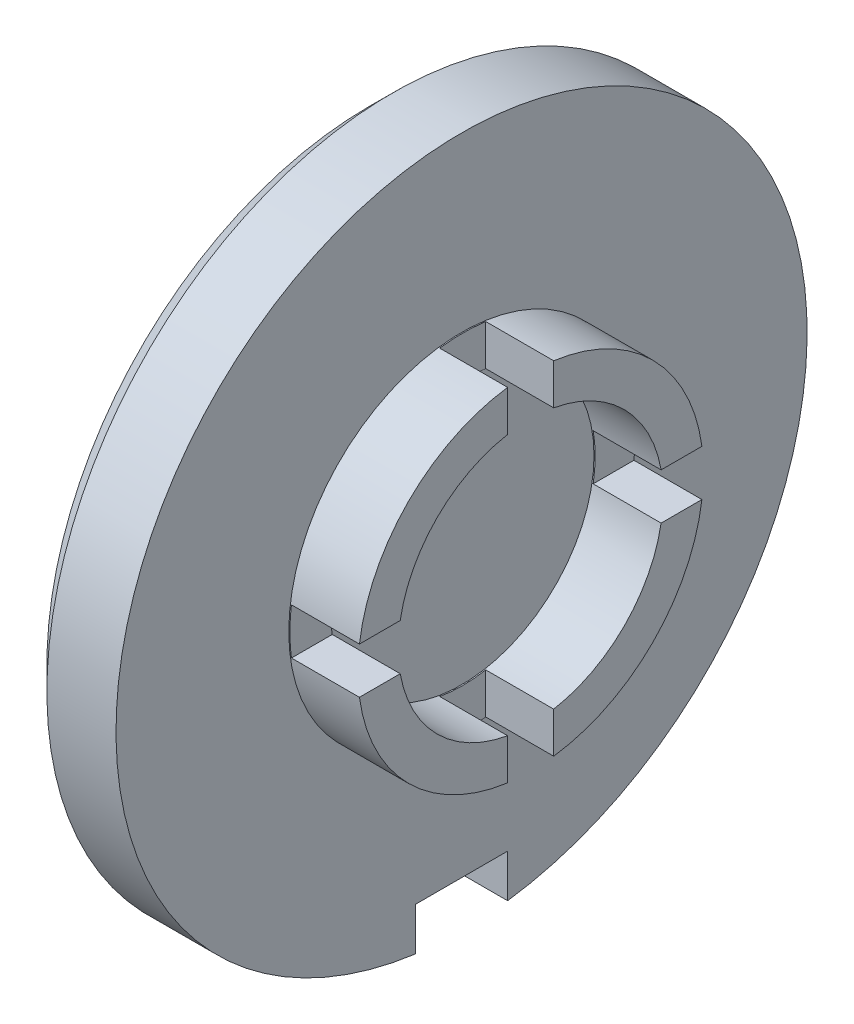
from build123d import *

# Parameters (mm, degrees)
BOSS_EXTRUDE1_START = 62.8
SKETCH2_W           = 1.28
SKETCH2_H           = 0.8
BOSS_EXTRUDE1_DEPTH = 6.4
BOSS_EXTRUDE2_START = 65.6
SKETCH3_W           = 1.28
SKETCH3_H           = 6.4
BOSS_EXTRUDE2_DEPTH = 0.8
BOSS_EXTRUDE3_START = 65.2
SKETCH4_W           = 1.8
SKETCH4_H           = 0.9
BOSS_EXTRUDE3_DEPTH = 1.6


with BuildPart() as part:
    # Sketch1 → Revolve1 (revolve)
    with BuildSketch(Plane.XY.offset(66), mode=Mode.PRIVATE) as revolve1_sk:
        Polygon((-58.2, 20.3), (-59.4, 20.3), (-59.4, 18), (-61, 18), (-61, 23.6), (-60.6, 24), (-59.4, 24), (-59.4, 21), (-58.2, 21), align=None)
    revolve(revolve1_sk.sketch.rotate(Axis((-66, 18, 66), (1, 0, 0)), 90), axis=Axis((-66, 18, 66), (1, 0, 0)))


with BuildPart() as body_2:
    # Sketch2 → Boss-Extrude1 (new body)
    with BuildSketch(Plane.XY.offset(BOSS_EXTRUDE1_START)):
        with Locations((-58.74, 18)):
            Rectangle(SKETCH2_W, SKETCH2_H)
    extrude(amount=BOSS_EXTRUDE1_DEPTH)


with BuildPart() as part_1:
    add(part.part)

    # Combine1: cut body 2
    add(body_2.part, mode=Mode.SUBTRACT)


with BuildPart() as body_2_2:
    # Sketch3 → Boss-Extrude2 (new body)
    with BuildSketch(Plane.XY.offset(BOSS_EXTRUDE2_START)):
        with Locations((-58.74, 18)):
            Rectangle(SKETCH3_W, SKETCH3_H)
    extrude(amount=BOSS_EXTRUDE2_DEPTH)


with BuildPart() as part_2:
    add(part_1.part)

    # Combine2: cut body 2 2
    add(body_2_2.part, mode=Mode.SUBTRACT)


with BuildPart() as body_2_3:
    # Sketch4 → Boss-Extrude3 (new body)
    with BuildSketch(Plane.XY.offset(BOSS_EXTRUDE3_START)):
        with Locations((-60.2, 12.35)):
            Rectangle(SKETCH4_W, SKETCH4_H)
    extrude(amount=BOSS_EXTRUDE3_DEPTH)


with BuildPart() as part_3:
    add(part_2.part)

    # Combine3: cut body 2 3
    add(body_2_3.part, mode=Mode.SUBTRACT)


solid = part_3.part
